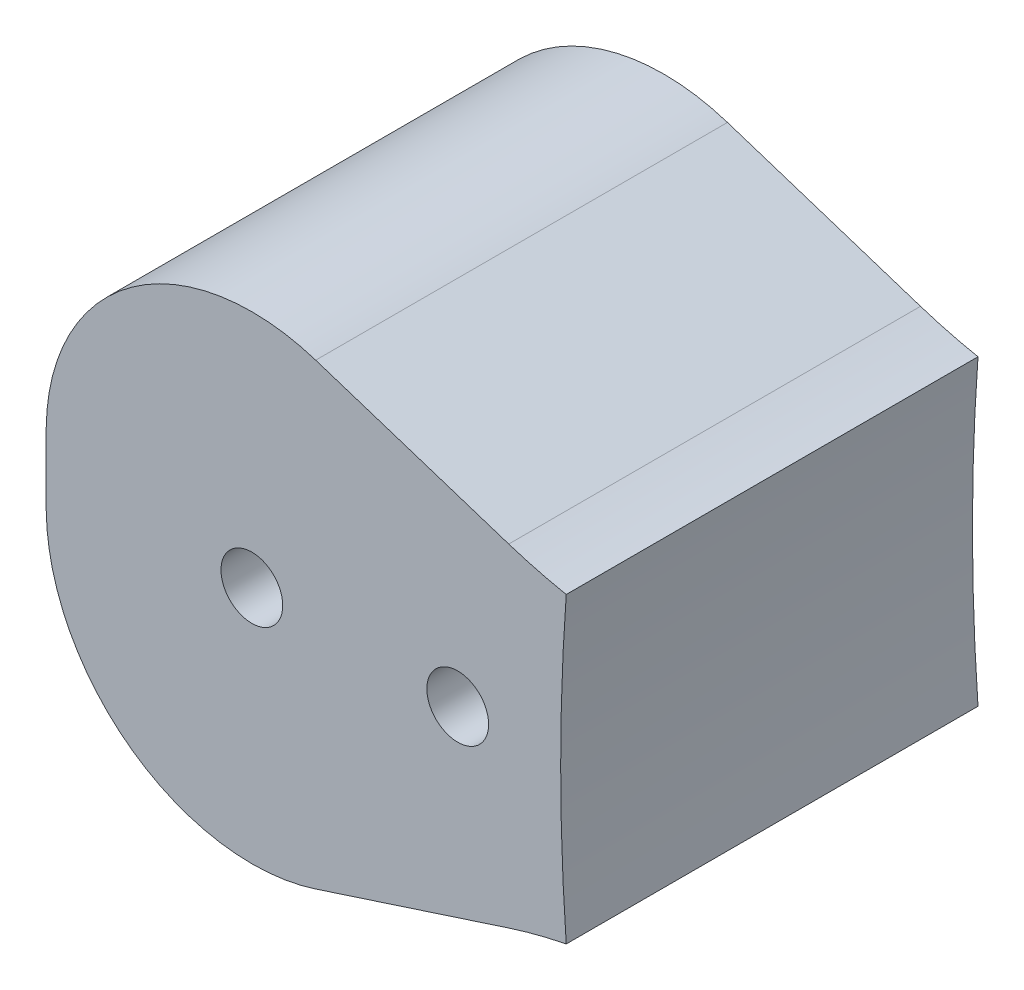
from build123d import *

# Parameters (mm, degrees)
EXTRUDE_1_DEPTH = 20


with BuildPart() as part:
    # 草图1 → 凸台-拉伸1 (new body)
    with BuildSketch(Plane.XY):
        with BuildLine():
            Line((-102.522059495, 8.076343046), (-111.898526204, 11.122941761))
            ThreePointArc((-111.898526204, 11.122941761), (-120.809688049, 9.743554451), (-124.987713204, 1.752583259))
            ThreePointArc((-124.987713204, 1.752583259), (-125, 0), (-124.987713204, -1.752583259))
            ThreePointArc((-124.987713204, -1.752583259), (-120.809688049, -9.743554451), (-111.898526204, -11.122941761))
            Line((-111.898526204, -11.122941761), (-102.522059495, -8.076343046))
            ThreePointArc((-102.522059495, -8.076343046), (-101.136647244, -7.671824451), (-99.729424961, -7.3513126))
            ThreePointArc((-99.729424961, -7.3513126), (-100, 0), (-99.729424961, 7.3513126))
            ThreePointArc((-99.729424961, 7.3513126), (-101.136647244, 7.671824451), (-102.522059495, 8.076343046))
        make_face()
        with BuildLine():
            ThreePointArc((-106.426584774, -0.463525492), (-104.536474508, -1.426584774), (-103.573415226, 0.463525492))
            ThreePointArc((-103.573415226, 0.463525492), (-105.463525492, 1.426584774), (-106.426584774, -0.463525492))
        make_face(mode=Mode.SUBTRACT)
        with BuildLine():
            ThreePointArc((-116.426584774, -0.463525492), (-114.536474508, -1.426584774), (-113.573415226, 0.463525492))
            ThreePointArc((-113.573415226, 0.463525492), (-115.463525492, 1.426584774), (-116.426584774, -0.463525492))
        make_face(mode=Mode.SUBTRACT)
    extrude(amount=EXTRUDE_1_DEPTH)


solid = part.part
